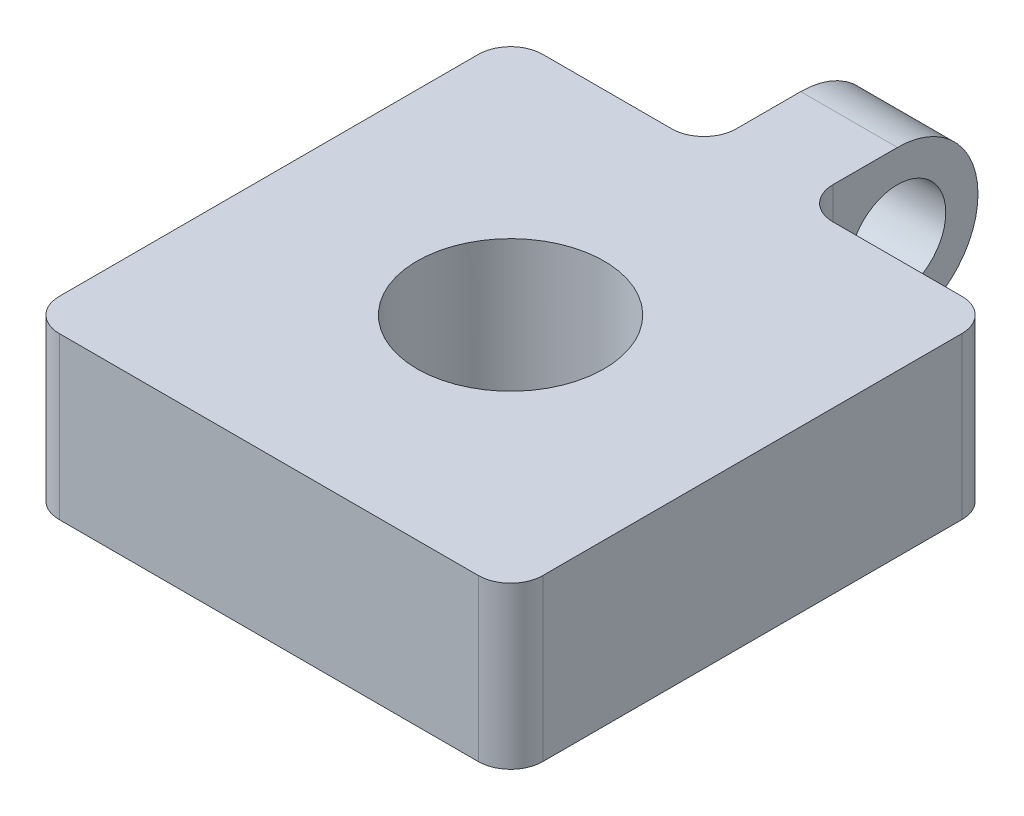
from build123d import *

# Parameters (mm, degrees)
SKETCH1_W           = 15
SKETCH1_H           = 15
BOSS_EXTRUDE1_DEPTH = 5
SKETCH3_R           = 1.5
BOSS_EXTRUDE2_DEPTH = 1.5
CUT_EXTRUDE1_REACH  = 17.819
SKETCH4_R           = 2.9
FILLET1_R           = 1


with BuildPart() as part:
    # Sketch1 → Boss-Extrude1 (new body)
    with BuildSketch(Plane(origin=(0, 0, 0), x_dir=(1, 0, 0), z_dir=(0, 1, 0))):
        Rectangle(SKETCH1_W, SKETCH1_H)
    extrude(amount=BOSS_EXTRUDE1_DEPTH)

    # Sketch3 → Boss-Extrude2 (add, symmetric)
    with BuildSketch(Plane(origin=(0, 0, 0), x_dir=(0, 0, -1), z_dir=(1, 0, 0))):
        with BuildLine():
            Line((7.5, 5), (10.5, 5))
            ThreePointArc((10.5, 5), (13, 2.5), (10.5, 0))
            Line((10.5, 0), (7.5, 0))
            Line((7.5, 0), (7.5, 5))
        make_face()
        with Locations((10.5, 2.5)):
            Circle(SKETCH3_R, mode=Mode.SUBTRACT)
    extrude(amount=BOSS_EXTRUDE2_DEPTH, both=True)

    # Sketch4 → Cut-Extrude1 (cut, up to next)
    with BuildSketch(Plane(origin=(0, 5, 0), x_dir=(1, 0, 0), z_dir=(0, 1, 0)), mode=Mode.PRIVATE) as cut_extrude1_sk1:
        with Locations(Location((0, 0, 0), (0, 0, 270))):
            Circle(SKETCH4_R)
    cut_extrude1_tool1 = extrude(cut_extrude1_sk1.sketch, amount=-CUT_EXTRUDE1_REACH, mode=Mode.PRIVATE) & part.part
    add(cut_extrude1_tool1.solids().sort_by_distance((0, 5, 0))[0], mode=Mode.SUBTRACT)

    # Fillet1
    fillet1_edges = [part.edges().sort_by_distance(p)[0] for p in [
        (1.5, 2.5, -7.5),
        (-1.5, 2.5, -7.5),
        (7.5, 2.5, 7.5),
        (-7.5, 2.5, 7.5),
        (-7.5, 2.5, -7.5),
        (7.5, 2.5, -7.5),
    ]]
    fillet(fillet1_edges, radius=FILLET1_R)


solid = part.part
